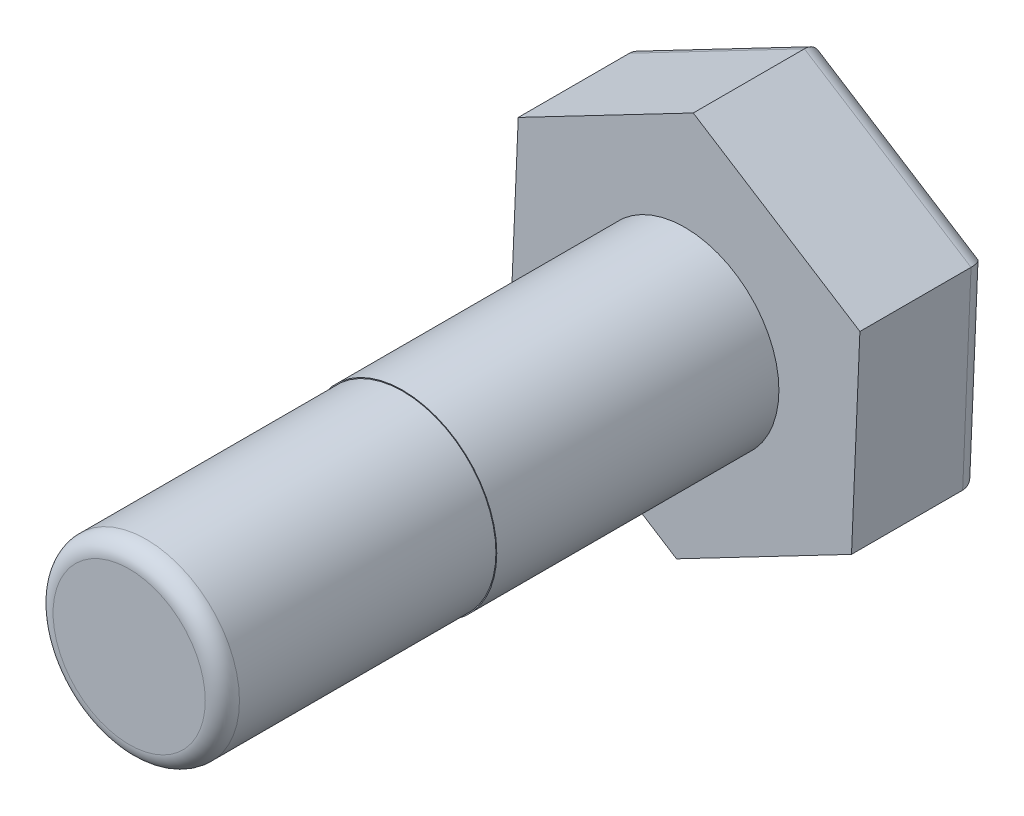
from build123d import *

# Parameters (mm, degrees)
EXTRUDE_397_DEPTH = 15
SKETCH_2_R        = 11
EXTRUDE_1_DEPTH   = 33
FILLET_3_R        = 2
SKETCH_3_R        = 10.9
EXTRUDE_1_2_DEPTH = 32
FILLET_4_R        = 2


with BuildPart() as part:
    # 草图1 → Extrude 397 (new body)
    with BuildSketch(Plane.XY):
        Polygon((20.472392036, 10.687118304), (0.980880074, 23.073170732), (-19.491511963, 12.386052428), (-20.472392036, -10.687118304), (-0.980880074, -23.073170732), (19.491511963, -12.386052428), align=None)
    extrude(amount=EXTRUDE_397_DEPTH)

    # 草图2 → Extrude 1 (add)
    with BuildSketch(Plane.XY.offset(15)):
        Circle(SKETCH_2_R)
    extrude(amount=EXTRUDE_1_DEPTH)

    # 圆角3
    fillet_3_edges = [part.edges().sort_by_distance(p)[0] for p in [
        (9.255315945, -17.72961158, 0),
        (-10.726636055, -16.880144518, 0),
        (-19.981952, 0.849467062, 0),
        (-9.255315945, 17.72961158, 0),
        (10.726636055, 16.880144518, 0),
        (19.981952, -0.849467062, 0),
    ]]
    fillet(fillet_3_edges, radius=FILLET_3_R)

    # 草图3 → Extrude 1 2 (add)
    with BuildSketch(Plane.XY.offset(48)):
        Circle(SKETCH_3_R)
    extrude(amount=EXTRUDE_1_2_DEPTH)

    # 圆角4
    fillet_4_edges = [part.edges().sort_by_distance(p)[0] for p in [
        (-10.9, 0, 80),
    ]]
    fillet(fillet_4_edges, radius=FILLET_4_R)


solid = part.part
